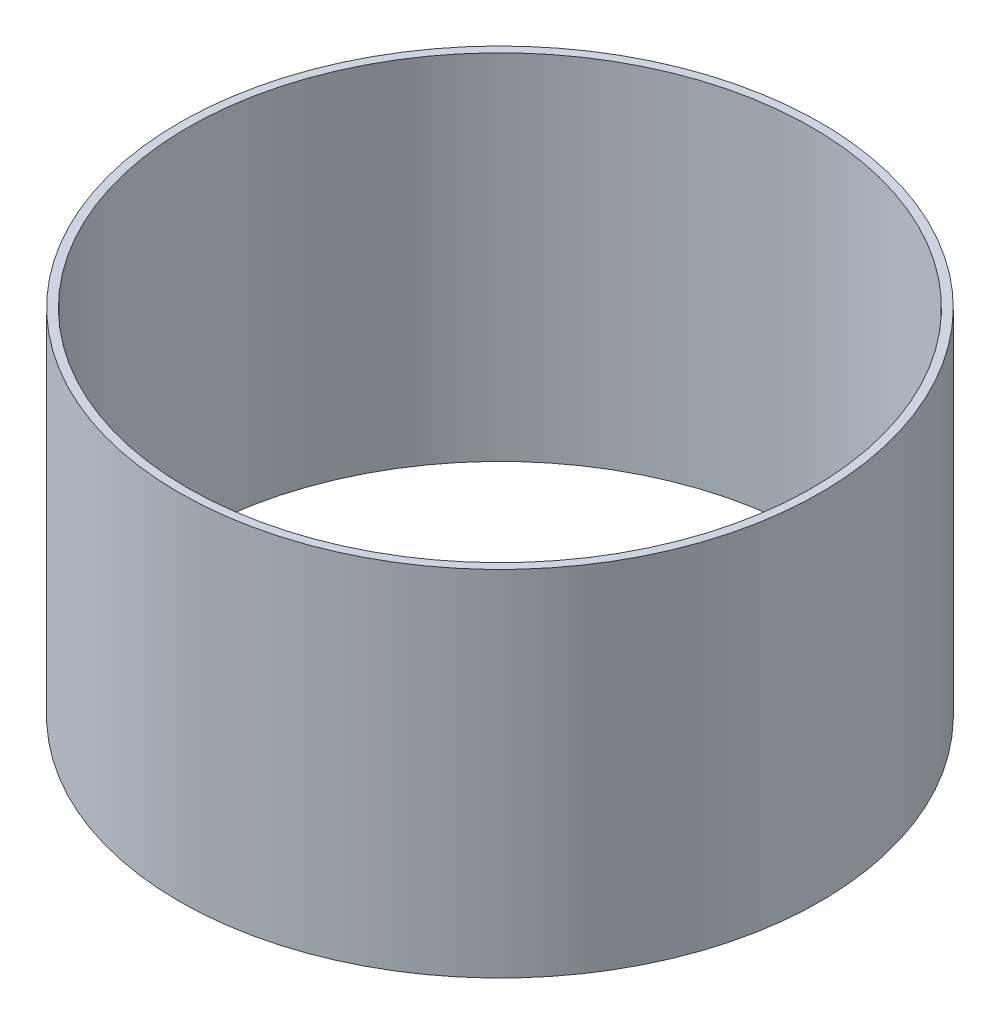
from build123d import *

# Parameters (mm, degrees)
SKETCH1_R           = 38.5
SKETCH1_R_2         = 37.5
BOSS_EXTRUDE1_DEPTH = 42.5


with BuildPart() as part:
    # Sketch1 → Boss-Extrude1 (new body)
    with BuildSketch(Plane(origin=(0, 0, 0), x_dir=(1, 0, 0), z_dir=(0, 1, 0))):
        with Locations(Location((0, 0, 0), (0, 0, 270))):
            Circle(SKETCH1_R)
        with Locations(Location((0, 0, 0), (0, 0, 270))):
            Circle(SKETCH1_R_2, mode=Mode.SUBTRACT)
    extrude(amount=BOSS_EXTRUDE1_DEPTH)


solid = part.part
